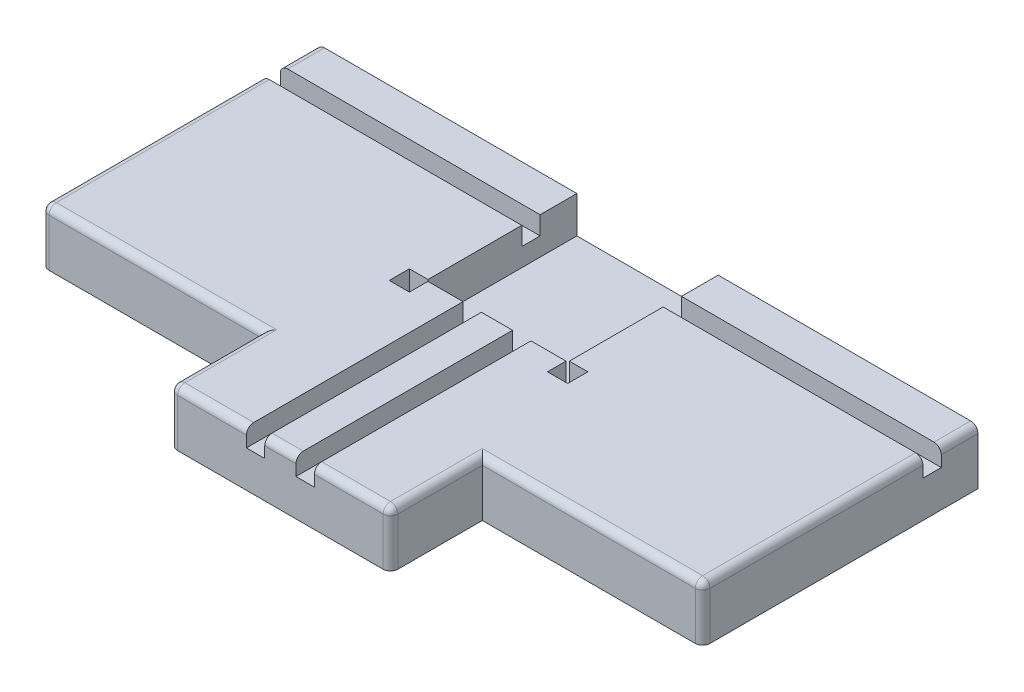
from build123d import *

# Parameters (mm, degrees)
SKETCH1_W                                  = 180
SKETCH1_H                                  = 150
BOSS_EXTRUDE1_DEPTH                        = 15
SKETCH7_W                                  = 60
SKETCH7_H                                  = 25
BOSS_EXTRUDE6_DEPTH                        = 15
FILLET1_R                                  = 2
SKETCH2_W                                  = 38.5
SKETCH2_H                                  = 82
CUT_EXTRUDE1_DEPTH                         = 10
CUT_EXTRUDE3_DEPTH                         = 5
SKETCH11_W                                 = 5.5
SKETCH11_H                                 = 5.5
CUT_EXTRUDE6_DEPTH                         = 7
MIRROR3_AT_THE_SECOND_PLANE_COPY_1_SKETC_W = 5.5
MIRROR3_AT_THE_SECOND_PLANE_COPY_1_SKETC_H = 5.5
MIRROR3_AT_THE_SECOND_PLANE_COPY_1_DEPTH   = 7
MIRROR4_AT_THE_SECOND_PLANE_COPY_1_DEPTH   = 5
SKETCH12_W                                 = 194.678765725
SKETCH12_H                                 = 23.459831827
CUT_EXTRUDE7_DEPTH                         = 136.369863707


with BuildPart() as part:
    # Sketch1 → Boss-Extrude1 (new body)
    with BuildSketch(Plane(origin=(0, 0, 0), x_dir=(1, 0, 0), z_dir=(0, 1, 0))):
        Rectangle(SKETCH1_W, SKETCH1_H)
    extrude(amount=BOSS_EXTRUDE1_DEPTH)

    # Sketch7 → Boss-Extrude6 (add)
    with BuildSketch(Plane(origin=(0, 0, 0), x_dir=(1, 0, 0), z_dir=(0, 1, 0))):
        with Locations((0, -87.5)):
            Rectangle(SKETCH7_W, SKETCH7_H)
        with Locations((0, 87.5)):
            Rectangle(SKETCH7_W, SKETCH7_H)
    extrude(amount=BOSS_EXTRUDE6_DEPTH)

    # Fillet1
    fillet1_edges = [part.edges().sort_by_distance(p)[0] for p in [
        (-90, 15, 0),
        (60, 15, 75),
        (-60, 15, 75),
        (-30, 7.5, 100),
        (30, 7.5, 100),
        (-30, 15, 87.5),
        (0, 15, 100),
        (30, 15, 87.5),
        (-60, 15, -75),
        (0, 15, -100),
        (30, 7.5, -100),
        (-30, 15, -87.5),
        (-30, 7.5, -100),
        (30, 15, -87.5),
        (90, 15, 0),
        (90, 7.5, 75),
        (-90, 7.5, 75),
        (-90, 7.5, -75),
        (90, 7.5, -75),
        (60, 15, -75),
    ]]
    fillet(fillet1_edges, radius=FILLET1_R)

    # Sketch2 → Cut-Extrude1 (cut)
    with BuildSketch(Plane(origin=(0, 15, 0), x_dir=(1, 0, 0), z_dir=(0, 1, 0))):
        Rectangle(SKETCH2_W, SKETCH2_H)
    extrude(amount=-CUT_EXTRUDE1_DEPTH, mode=Mode.SUBTRACT)

    # Sketch10 → Cut-Extrude3 (cut)
    with BuildSketch(Plane(origin=(0, 15, 0), x_dir=(1, 0, 0), z_dir=(0, 1, 0))):
        Polygon((-9.25, -40.5), (-9.25, -33.162899401), (-4.25, -33.162899401), (-4.25, -40.5), (-4.25, -105.687952047), (-9.25, -105.687952047), align=None)
        Polygon((-99.022946063, 15), (-19.25, 15), (-11.555108838, 15), (-11.555108838, 10), (-19.25, 10), (-99.022946063, 10), align=None)
    cut_extrude3 = extrude(amount=-CUT_EXTRUDE3_DEPTH, mode=Mode.SUBTRACT)

    # Sketch11 → Cut-Extrude6 (cut)
    with BuildSketch(Plane(origin=(0, 15, 0), x_dir=(1, 0, 0), z_dir=(0, 1, 0))):
        with Locations((-21.549732367, 43.299732367)):
            Rectangle(SKETCH11_W, SKETCH11_H)
    cut_extrude6 = extrude(amount=-CUT_EXTRUDE6_DEPTH, mode=Mode.SUBTRACT)

    # Mirror3: Cut-Extrude6 across plane
    add(cut_extrude6.mirror(Plane(origin=(0, 0, 0), x_dir=(0, 0, 1), z_dir=(1, 0, 0))), mode=Mode.SUBTRACT)

    # Mirror3 at the second plane: Cut-Extrude6 across plane
    add(cut_extrude6.mirror(Plane.XY), mode=Mode.SUBTRACT)

    # Mirror3 at the second plane copy 1 sketc → Mirror3 at the second plane copy 1 (cut)
    with BuildSketch(Plane(origin=(0, 15, 0), x_dir=(-1, 0, 0), z_dir=(0, 1, 0))):
        with Locations((-21.549732367, 43.299732367)):
            Rectangle(MIRROR3_AT_THE_SECOND_PLANE_COPY_1_SKETC_W, MIRROR3_AT_THE_SECOND_PLANE_COPY_1_SKETC_H)
    extrude(amount=-MIRROR3_AT_THE_SECOND_PLANE_COPY_1_DEPTH, mode=Mode.SUBTRACT)

    # Mirror4: Cut-Extrude3 across plane
    add(cut_extrude3.mirror(Plane(origin=(0, 0, 0), x_dir=(0, 0, 1), z_dir=(1, 0, 0))), mode=Mode.SUBTRACT)

    # Mirror4 at the second plane: Cut-Extrude3 across plane
    add(cut_extrude3.mirror(Plane.XY), mode=Mode.SUBTRACT)

    # Mirror4 at the second plane copy 1 sketc → Mirror4 at the second plane copy 1 (cut)
    with BuildSketch(Plane(origin=(0, 15, 0), x_dir=(-1, 0, 0), z_dir=(0, 1, 0))):
        Polygon((-9.25, -40.5), (-9.25, -33.162899401), (-4.25, -33.162899401), (-4.25, -40.5), (-4.25, -105.687952047), (-9.25, -105.687952047), align=None)
        Polygon((-99.022946063, 15), (-19.25, 15), (-11.555108838, 15), (-11.555108838, 10), (-19.25, 10), (-99.022946063, 10), align=None)
    extrude(amount=-MIRROR4_AT_THE_SECOND_PLANE_COPY_1_DEPTH, mode=Mode.SUBTRACT)

    # Sketch12 → Cut-Extrude7 (cut, through all)
    with BuildSketch(Plane.XY):
        with Locations((1.797325826, 6.648635136)):
            Rectangle(SKETCH12_W, SKETCH12_H)
    extrude(amount=-CUT_EXTRUDE7_DEPTH, mode=Mode.SUBTRACT)


solid = part.part
